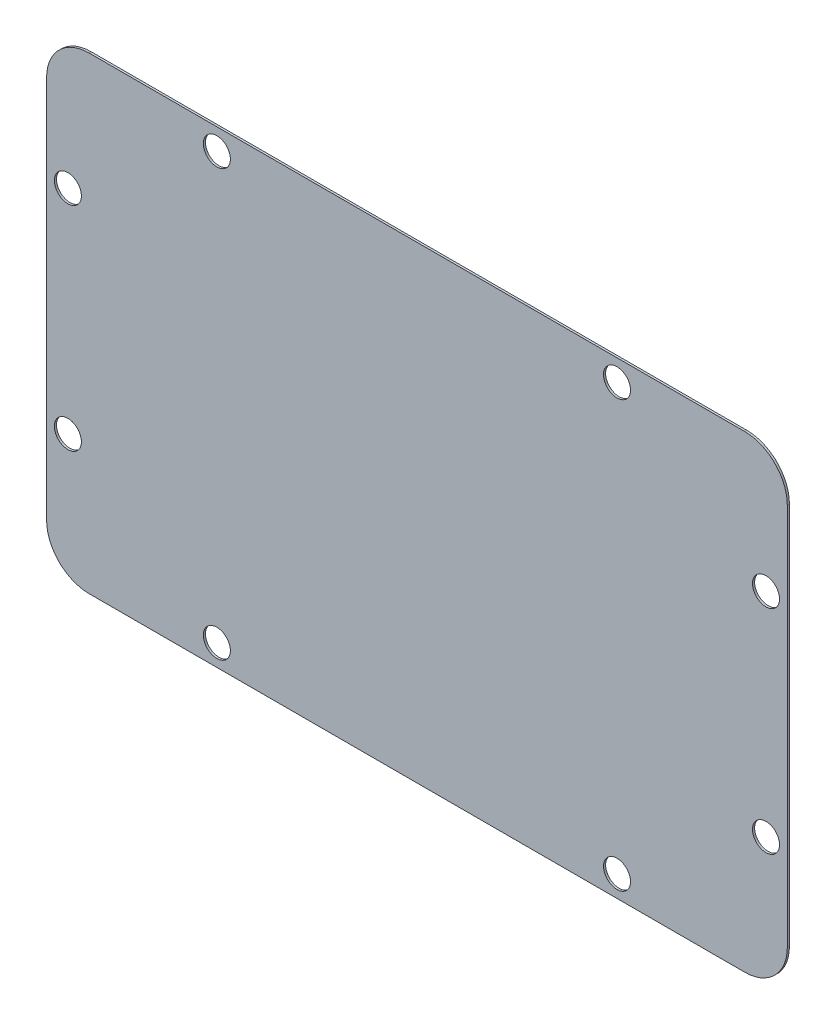
from build123d import *

# Parameters (mm, degrees)
RESSALTO_EXTRUS_O1_DEPTH                       = 0.5
BROCA_DE_ROSQUEAR_PARA_TARRAXA_DE_M3X0_5_D     = 6.35
BROCA_DE_ROSQUEAR_PARA_TARRAXA_DE_M3X0_5_DEPTH = 23.492267535
BROCA_DE_ROSQUEAR_PARA_TARRAXA_DE_M3X0_5_TIP   = 1.907732465


with BuildPart() as part:
    # Esboço1 → Ressalto-extrusão1 (new body)
    with BuildSketch(Plane.XY):
        with BuildLine():
            Line((-10, 0), (-164, 0))
            ThreePointArc((-164, 0), (-171.071067812, 2.928932188), (-174, 10))
            Line((-174, 10), (-174, 100))
            ThreePointArc((-174, 100), (-171.071067812, 107.071067812), (-164, 110))
            Line((-164, 110), (-10, 110))
            ThreePointArc((-10, 110), (-2.928932188, 107.071067812), (0, 100))
            Line((0, 100), (0, 10))
            ThreePointArc((0, 10), (-2.928932188, 2.928932188), (-10, 0))
        make_face()
    extrude(amount=RESSALTO_EXTRUS_O1_DEPTH)

    # Broca de rosquear para tarraxa de M3x0.51
    with Locations(Plane.XY.offset(0.5)):
        with Locations((-169, 80), (-134, 105), (-40, 105), (-5, 80), (-5, 30), (-169, 30), (-134, 5), (-40, 5)):
            Hole(BROCA_DE_ROSQUEAR_PARA_TARRAXA_DE_M3X0_5_D / 2, depth=BROCA_DE_ROSQUEAR_PARA_TARRAXA_DE_M3X0_5_DEPTH)
            with Locations((0, 0, -(BROCA_DE_ROSQUEAR_PARA_TARRAXA_DE_M3X0_5_DEPTH + BROCA_DE_ROSQUEAR_PARA_TARRAXA_DE_M3X0_5_TIP / 2))):  # 118° drill point
                Cone(0, BROCA_DE_ROSQUEAR_PARA_TARRAXA_DE_M3X0_5_D / 2, BROCA_DE_ROSQUEAR_PARA_TARRAXA_DE_M3X0_5_TIP, mode=Mode.SUBTRACT)


solid = part.part
